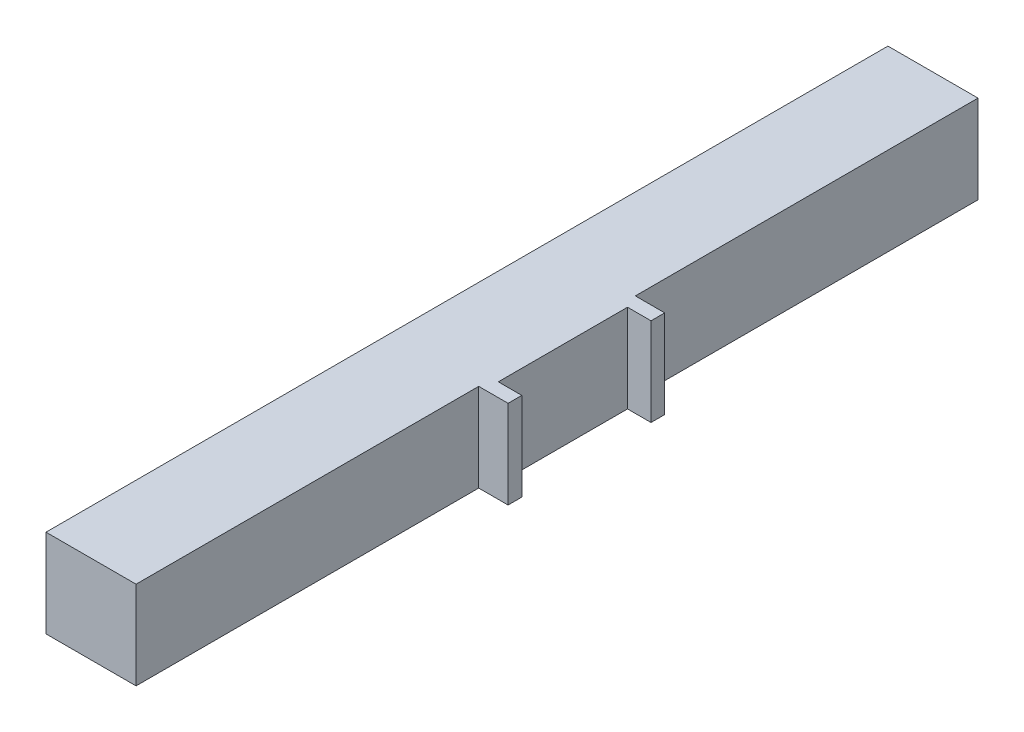
from build123d import *

# Parameters (mm, degrees)
SKETCH1_W           = 46
SKETCH1_H           = 45
BOSS_EXTRUDE1_DEPTH = 430
SKETCH2_W           = 40
SKETCH2_H           = 45
BOSS_EXTRUDE2_DEPTH = 15
SKETCH3_W           = 12
SKETCH3_H           = 66
CUT_EXTRUDE2_DEPTH  = 3434


with BuildPart() as part:
    # Sketch1 → Boss-Extrude1 (new body)
    with BuildSketch(Plane.XY):
        Rectangle(SKETCH1_W, SKETCH1_H)
    extrude(amount=BOSS_EXTRUDE1_DEPTH)

    # Sketch2 → Boss-Extrude2 (add)
    with BuildSketch(Plane(origin=(23, 0, 0), x_dir=(0, 0, -1), z_dir=(1, 0, 0))):
        with Locations((-195, 0)):
            Rectangle(SKETCH2_W, SKETCH2_H)
        with Locations((-235, 0)):
            Rectangle(SKETCH2_W, SKETCH2_H)
    extrude(amount=BOSS_EXTRUDE2_DEPTH)

    # Sketch3 → Cut-Extrude2 (cut)
    with BuildSketch(Plane(origin=(0, 22.5, 0), x_dir=(1, 0, 0), z_dir=(0, 1, 0))):
        with Locations((32, -215)):
            Rectangle(SKETCH3_W, SKETCH3_H)
    extrude(amount=-CUT_EXTRUDE2_DEPTH, mode=Mode.SUBTRACT)


solid = part.part
